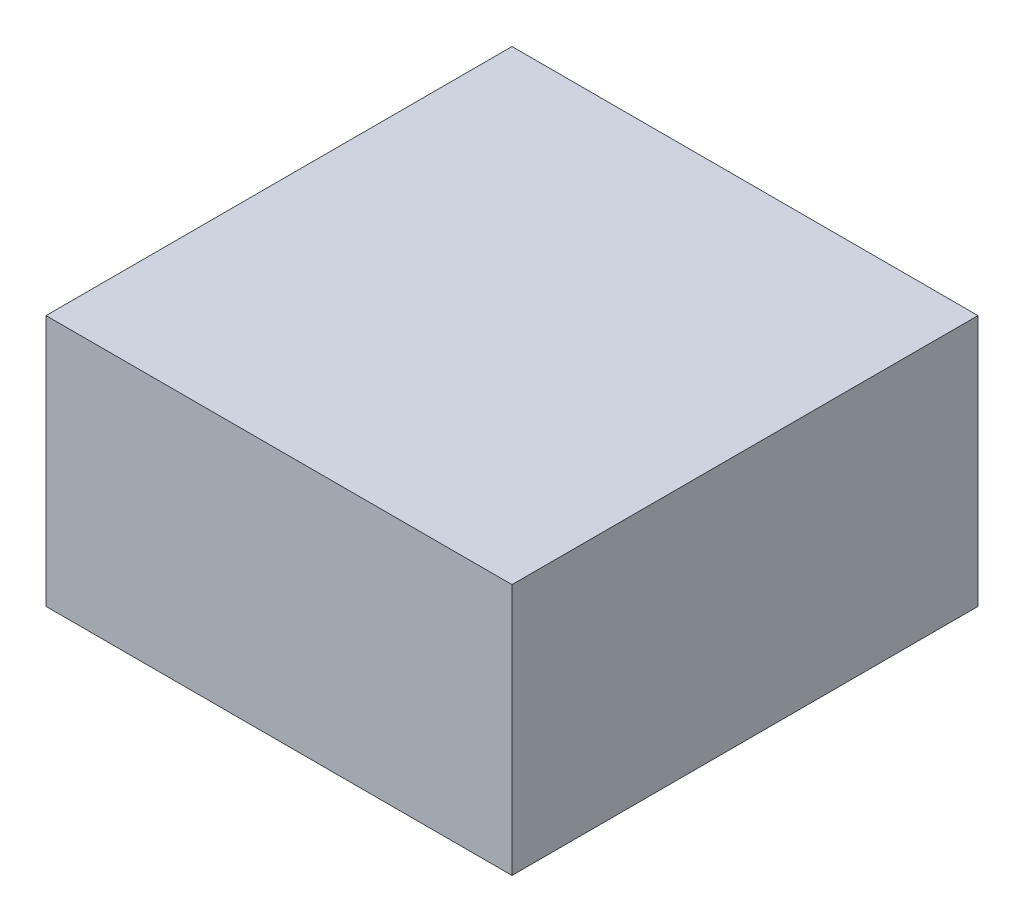
from build123d import *

# Parameters (mm, degrees)
SKETCH_1_W               = 18.5
SKETCH_1_H               = 18.5
EXTRUDE_2_DEPTH          = 10
CUT_EXTRUDE_1_DEPTH      = 8
CUT_EXTRUDE_1_DEPTH_BACK = 10
SKETCH_1_5_W             = 15
SKETCH_1_5_H             = 15
SKETCH_1_8_R             = 3
EXTRUDE_3_DEPTH          = 8


with BuildPart() as part:
    # 草图1 → 凸台-拉伸2 (new body)
    with BuildSketch(Plane(origin=(-54.452348576, 0, -10.111307481), x_dir=(1, 0, 0), z_dir=(0, 1, 0))):
        with Locations((-0.232982833, 0.198747616)):
            Rectangle(SKETCH_1_W, SKETCH_1_H)
    extrude(amount=EXTRUDE_2_DEPTH)

    # 草图1<5> → 切除-拉伸1 (cut, two sides: drawn at the far end of the back side and taken through both)
    with BuildSketch(Plane(origin=(-54.452348576, 0, -10.111307481), x_dir=(1, 0, 0), z_dir=(0, 1, 0)).offset(-CUT_EXTRUDE_1_DEPTH_BACK)):
        with Locations((-0.232977593, 0.198745421)):
            Rectangle(SKETCH_1_5_W, SKETCH_1_5_H)
    extrude(amount=CUT_EXTRUDE_1_DEPTH + CUT_EXTRUDE_1_DEPTH_BACK, mode=Mode.SUBTRACT)


with BuildPart() as body_2:
    # 草图1<8> → 凸台-拉伸3 (new body)
    with BuildSketch(Plane(origin=(-54.452348576, 0, -10.111307481), x_dir=(1, 0, 0), z_dir=(0, 1, 0))):
        with Locations(Location((-32.631590837, 12.584276694, 0), (0, 0, 270))):
            Circle(SKETCH_1_8_R)
        Polygon((-34.631589769, 12.124234893), (-34.631589769, 13.124234893), (-33.131574719, 13.124234893), (-33.131574719, 14.5842993), (-32.131574719, 14.5842993), (-32.131574719, 13.124234893), (-30.631589769, 13.124234893), (-30.631589769, 12.124234893), (-32.131574719, 12.124234893), (-32.131574719, 10.5842993), (-33.131574719, 10.5842993), (-33.131574719, 12.124234893), align=None, mode=Mode.SUBTRACT)
    extrude(amount=EXTRUDE_3_DEPTH)


solid = part.part
